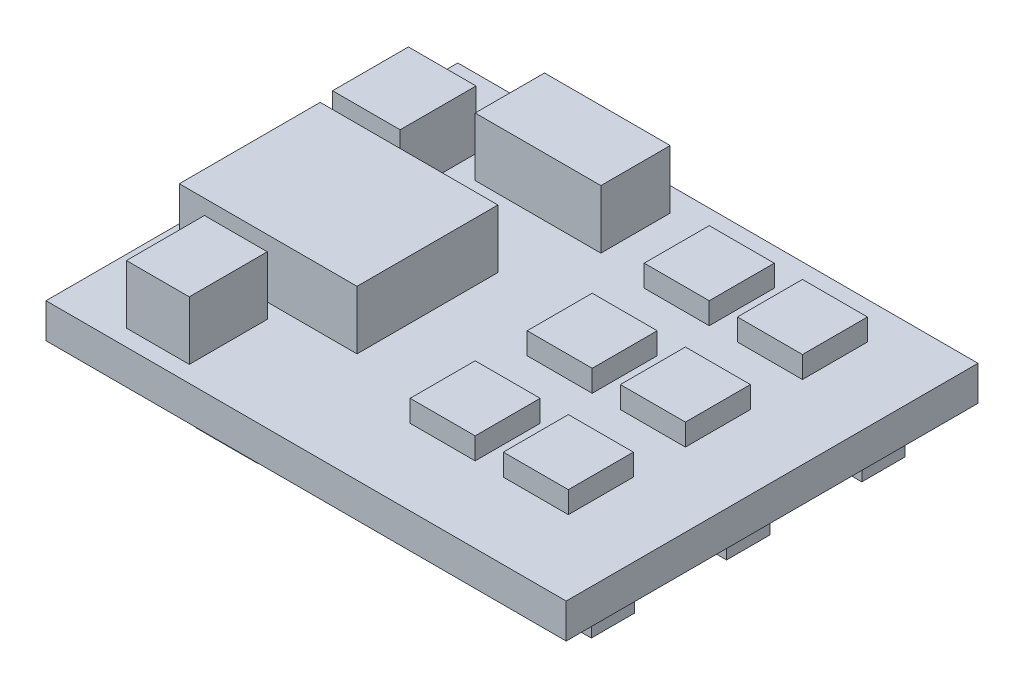
from build123d import *

# Parameters (mm, degrees)
SKETCH1_W             = 24
SKETCH1_H             = 19
BOSS_EXTRUDE1_DEPTH   = 1.6
SKETCH2_W             = 8.2
SKETCH2_H             = 6.5
BOSS_EXTRUDE2_DEPTH   = 2.7
SKETCH2_W_2           = 2.9
SKETCH2_H_2           = 3.6
BOSS_EXTRUDE2_2_DEPTH = 2.7
SKETCH2_W_3           = 5.8
SKETCH2_H_3           = 3.2
BOSS_EXTRUDE2_3_DEPTH = 2.7
SKETCH2_W_4           = 3.12
SKETCH2_H_4           = 3.5
BOSS_EXTRUDE2_4_DEPTH = 2.7
SKETCH3_W             = 3
SKETCH3_H             = 3
BOSS_EXTRUDE3_DEPTH   = 1
BOSS_EXTRUDE3_2_DEPTH = 1
BOSS_EXTRUDE3_3_DEPTH = 1
BOSS_EXTRUDE3_4_DEPTH = 1
BOSS_EXTRUDE3_5_DEPTH = 1
BOSS_EXTRUDE3_6_DEPTH = 1
SKETCH4_W             = 2.9
SKETCH4_H             = 3.6
BOSS_EXTRUDE4_DEPTH   = 2.32
SKETCH4_W_2           = 2.5
SKETCH4_H_2           = 4.5
BOSS_EXTRUDE4_2_DEPTH = 2.32
SKETCH4_W_3           = 1.5
SKETCH4_H_3           = 3.14
BOSS_EXTRUDE4_3_DEPTH = 2.32
SKETCH5_W             = 8
SKETCH5_H             = 8
BOSS_EXTRUDE5_DEPTH   = 1
SKETCH5_W_2           = 1.26
SKETCH5_H_2           = 2
BOSS_EXTRUDE5_2_DEPTH = 1
BOSS_EXTRUDE5_3_DEPTH = 1
BOSS_EXTRUDE5_4_DEPTH = 1


with BuildPart() as part:
    # Sketch1 → Boss-Extrude1 (new body)
    with BuildSketch(Plane(origin=(0, 0, 0), x_dir=(1, 0, 0), z_dir=(0, 1, 0))):
        with Locations((3.442553191, -1.05106383)):
            Rectangle(SKETCH1_W, SKETCH1_H)
    extrude(amount=BOSS_EXTRUDE1_DEPTH)


with BuildPart() as body_2:
    # Sketch2 → Boss-Extrude2 (new body)
    with BuildSketch(Plane(origin=(0, 1.6, 0), x_dir=(1, 0, 0), z_dir=(0, 1, 0))):
        with Locations((-3.357446809, -2.25106383)):
            Rectangle(SKETCH2_W, SKETCH2_H)
    extrude(amount=BOSS_EXTRUDE2_DEPTH)


with BuildPart() as body_3:
    # Sketch2 → Boss-Extrude2 2 (new body)
    with BuildSketch(Plane(origin=(0, 1.6, 0), x_dir=(1, 0, 0), z_dir=(0, 1, 0))):
        with Locations((-4.157446809, -7.99106383)):
            Rectangle(SKETCH2_W_2, SKETCH2_H_2)
    extrude(amount=BOSS_EXTRUDE2_2_DEPTH)


with BuildPart() as body_4:
    # Sketch2 → Boss-Extrude2 3 (new body)
    with BuildSketch(Plane(origin=(0, 1.6, 0), x_dir=(1, 0, 0), z_dir=(0, 1, 0))):
        with Locations((-0.557446809, 5.74893617)):
            Rectangle(SKETCH2_W_3, SKETCH2_H_3)
    extrude(amount=BOSS_EXTRUDE2_3_DEPTH)


with BuildPart() as body_5:
    # Sketch2 → Boss-Extrude2 4 (new body)
    with BuildSketch(Plane(origin=(0, 1.6, 0), x_dir=(1, 0, 0), z_dir=(0, 1, 0))):
        with Locations((-6.077446809, 3.49893617)):
            Rectangle(SKETCH2_W_4, SKETCH2_H_4)
    extrude(amount=BOSS_EXTRUDE2_4_DEPTH)


with BuildPart() as body_6:
    # Sketch3 → Boss-Extrude3 (new body)
    with BuildSketch(Plane(origin=(0, 1.6, 0), x_dir=(1, 0, 0), z_dir=(0, 1, 0))):
        with Locations((6.242553191, 5.24893617)):
            Rectangle(SKETCH3_W, SKETCH3_H)
    extrude(amount=BOSS_EXTRUDE3_DEPTH)


with BuildPart() as body_7:
    # Sketch3 → Boss-Extrude3 2 (new body)
    with BuildSketch(Plane(origin=(0, 1.6, 0), x_dir=(1, 0, 0), z_dir=(0, 1, 0))):
        with Locations((10.542553191, 5.24893617)):
            Rectangle(SKETCH3_W, SKETCH3_H)
    extrude(amount=BOSS_EXTRUDE3_2_DEPTH)


with BuildPart() as body_8:
    # Sketch3 → Boss-Extrude3 3 (new body)
    with BuildSketch(Plane(origin=(0, 1.6, 0), x_dir=(1, 0, 0), z_dir=(0, 1, 0))):
        with Locations((6.242553191, -0.15106383)):
            Rectangle(SKETCH3_W, SKETCH3_H)
    extrude(amount=BOSS_EXTRUDE3_3_DEPTH)


with BuildPart() as body_9:
    # Sketch3 → Boss-Extrude3 4 (new body)
    with BuildSketch(Plane(origin=(0, 1.6, 0), x_dir=(1, 0, 0), z_dir=(0, 1, 0))):
        with Locations((10.542553191, -0.15106383)):
            Rectangle(SKETCH3_W, SKETCH3_H)
    extrude(amount=BOSS_EXTRUDE3_4_DEPTH)


with BuildPart() as body_10:
    # Sketch3 → Boss-Extrude3 5 (new body)
    with BuildSketch(Plane(origin=(0, 1.6, 0), x_dir=(1, 0, 0), z_dir=(0, 1, 0))):
        with Locations((6.242553191, -5.55106383)):
            Rectangle(SKETCH3_W, SKETCH3_H)
    extrude(amount=BOSS_EXTRUDE3_5_DEPTH)


with BuildPart() as body_11:
    # Sketch3 → Boss-Extrude3 6 (new body)
    with BuildSketch(Plane(origin=(0, 1.6, 0), x_dir=(1, 0, 0), z_dir=(0, 1, 0))):
        with Locations((10.542553191, -5.55106383)):
            Rectangle(SKETCH3_W, SKETCH3_H)
    extrude(amount=BOSS_EXTRUDE3_6_DEPTH)


with BuildPart() as body_12:
    # Sketch4 → Boss-Extrude4 (new body)
    with BuildSketch(Plane.XZ):
        with Locations((-2.517446809, 6.45106383)):
            Rectangle(SKETCH4_W, SKETCH4_H)
    extrude(amount=BOSS_EXTRUDE4_DEPTH)


with BuildPart() as body_13:
    # Sketch4 → Boss-Extrude4 2 (new body)
    with BuildSketch(Plane.XZ):
        with Locations((-5.807446809, 2.48106383)):
            Rectangle(SKETCH4_W_2, SKETCH4_H_2)
    extrude(amount=BOSS_EXTRUDE4_2_DEPTH)


with BuildPart() as body_14:
    # Sketch4 → Boss-Extrude4 3 (new body)
    with BuildSketch(Plane.XZ):
        with Locations((-7.227446809, -2.52893617)):
            Rectangle(SKETCH4_W_3, SKETCH4_H_3)
    extrude(amount=BOSS_EXTRUDE4_3_DEPTH)


with BuildPart() as body_15:
    # Sketch5 → Boss-Extrude5 (new body)
    with BuildSketch(Plane.XZ):
        with Locations((2.292553191, -0.14893617)):
            Rectangle(SKETCH5_W, SKETCH5_H)
    extrude(amount=BOSS_EXTRUDE5_DEPTH)


with BuildPart() as body_16:
    # Sketch5 → Boss-Extrude5 2 (new body)
    with BuildSketch(Plane.XZ):
        with Locations((14.272553191, 7.85106383)):
            Rectangle(SKETCH5_W_2, SKETCH5_H_2)
    extrude(amount=BOSS_EXTRUDE5_2_DEPTH)


with BuildPart() as body_17:
    # Sketch5 → Boss-Extrude5 3 (new body)
    with BuildSketch(Plane.XZ):
        with Locations((14.272553191, 1.61106383)):
            Rectangle(SKETCH5_W_2, SKETCH5_H_2)
    extrude(amount=BOSS_EXTRUDE5_3_DEPTH)


with BuildPart() as body_18:
    # Sketch5 → Boss-Extrude5 4 (new body)
    with BuildSketch(Plane.XZ):
        with Locations((14.272553191, -4.62893617)):
            Rectangle(SKETCH5_W_2, SKETCH5_H_2)
    extrude(amount=BOSS_EXTRUDE5_4_DEPTH)


solid = Compound([part.part, body_2.part, body_3.part, body_4.part, body_5.part, body_6.part, body_7.part, body_8.part, body_9.part, body_10.part, body_11.part, body_12.part, body_13.part, body_14.part, body_15.part, body_16.part, body_17.part, body_18.part])
